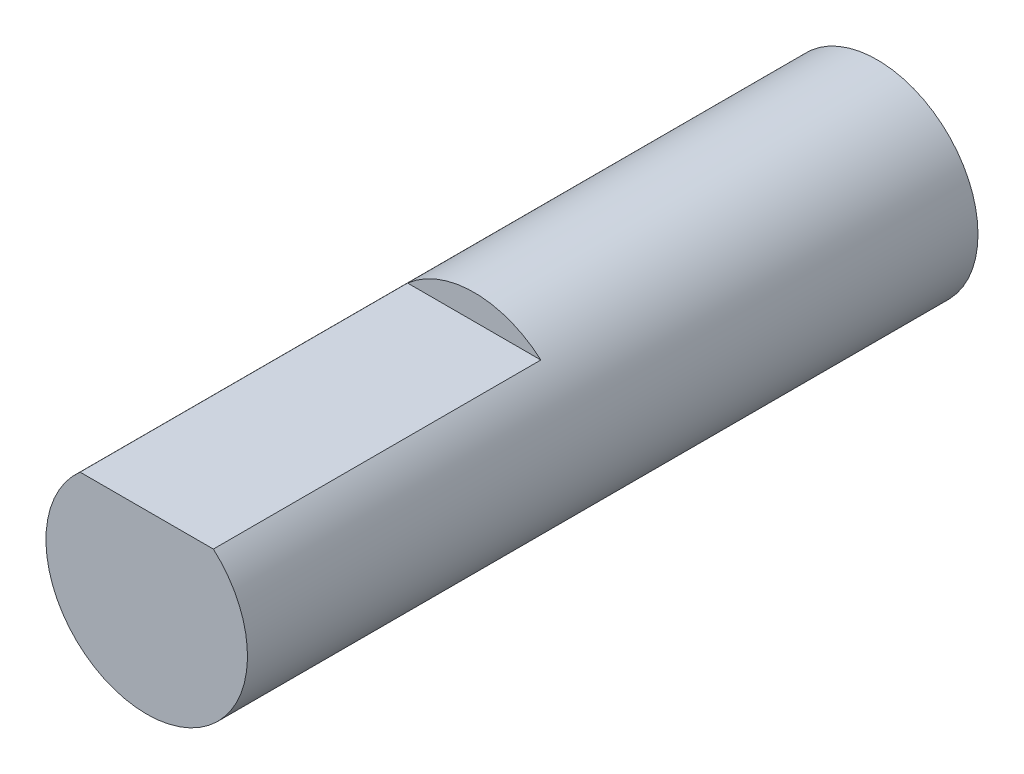
from build123d import *

# Parameters (mm, degrees)
SKETCH_1_R          = 4
EXTRUDE_1_DEPTH     = 29
CUT_EXTRUDE_START   = -13
CUT_EXTRUDE_1_DEPTH = 13


with BuildPart() as part:
    # 스케치1 → 보스-돌출1 (new body)
    with BuildSketch(Plane.XY):
        with Locations(Location((0, 0, 0), (0, 0, 180))):
            Circle(SKETCH_1_R)
    extrude(amount=EXTRUDE_1_DEPTH)

    # 스케치2 → 컷-돌출1 (cut)
    with BuildSketch(Plane.XY.offset(29).offset(CUT_EXTRUDE_START)):
        with BuildLine():
            Line((-2.645751311, 3), (2.645751311, 3))
            ThreePointArc((2.645751311, 3), (0, 4), (-2.645751311, 3))
        make_face()
    extrude(amount=CUT_EXTRUDE_1_DEPTH, mode=Mode.SUBTRACT)


solid = part.part
